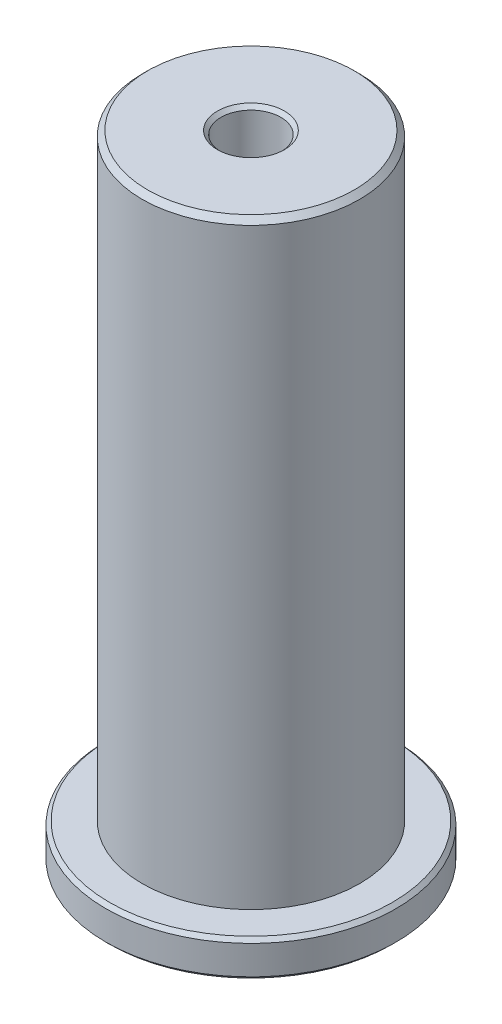
from build123d import *

# Parameters (mm, degrees)
SKETCH_1_R          = 8
SKETCH_1_R_2        = 6
EXTRUDE_1_DEPTH     = 2
SKETCH_1_3_R        = 6
SKETCH_1_3_R_2      = 1.65
EXTRUDE_2_DEPTH     = 35
SKETCH_2_R          = 1
CUT_EXTRUDE_1_DEPTH = 2
CUT_EXTRUDE_START   = 35
SKETCH_1_4_R        = 1.65
CUT_EXTRUDE_2_DEPTH = 13
CHAMFER_1_SIZE      = 0.2
CHAMFER_2_SIZE      = 0.3


with BuildPart() as part:
    # 스케치1 → 보스-돌출1 (new body)
    with BuildSketch(Plane(origin=(0, 0, 0), x_dir=(1, 0, 0), z_dir=(0, 1, 0))):
        with Locations(Location((0, 0, 0), (0, 0, 270))):
            Circle(SKETCH_1_R)
        with Locations(Location((0, 0, 0), (0, 0, 270))):
            Circle(SKETCH_1_R_2, mode=Mode.SUBTRACT)
    extrude(amount=EXTRUDE_1_DEPTH)

    # 스케치1<3> → 보스-돌출2 (add)
    # profile 1 of 2: a face of its own
    with BuildSketch(Plane(origin=(0, 0, 0), x_dir=(1, 0, 0), z_dir=(0, 1, 0))):
        with Locations(Location((0, 0, 0), (0, 0, 270))):
            Circle(SKETCH_1_3_R)
        Circle(SKETCH_1_3_R_2, mode=Mode.SUBTRACT)
    # profile 2 of 2: a face of its own
    with BuildSketch(Plane(origin=(0, 0, 0), x_dir=(1, 0, 0), z_dir=(0, 1, 0))):
        Circle(SKETCH_1_3_R_2)
    extrude(amount=EXTRUDE_2_DEPTH)

    # 스케치2 → 컷-돌출1 (cut)
    with BuildSketch(Plane.XZ):
        with Locations((0, 3)):
            Circle(SKETCH_2_R)
        with BuildLine():
            ThreePointArc((1, 3), (0, 2), (-1, 3))
            Line((-1, 3), (-1, -3))
            ThreePointArc((-1, -3), (0, -2), (1, -3))
            Line((1, -3), (1, 3))
        make_face()
        with Locations((0, -3)):
            Circle(SKETCH_2_R)
    extrude(amount=-CUT_EXTRUDE_1_DEPTH, mode=Mode.SUBTRACT)

    # 스케치1<4> → 컷-돌출2 (cut)
    with BuildSketch(Plane(origin=(0, 0, 0), x_dir=(1, 0, 0), z_dir=(0, 1, 0)).offset(CUT_EXTRUDE_START)):
        with Locations(Location((0, 0, 0), (0, 0, 270))):
            Circle(SKETCH_1_4_R)
    extrude(amount=-CUT_EXTRUDE_2_DEPTH, mode=Mode.SUBTRACT)

    # 모따기1
    chamfer_1_edges = [part.edges().sort_by_distance(p)[0] for p in [
        (0, 2, -8),
        (0, 35, -1.65),
        (0, 0, -8),
    ]]
    chamfer(chamfer_1_edges, length=CHAMFER_1_SIZE)

    # 모따기2
    chamfer_2_edges = [part.edges().sort_by_distance(p)[0] for p in [
        (0, 35, -6),
    ]]
    chamfer(chamfer_2_edges, length=CHAMFER_2_SIZE)

    # 스케치3 → 컷-회전1 (revolve, cut)
    with BuildSketch(Plane.XY, mode=Mode.PRIVATE) as cut_revolve_1_sk:
        Polygon((-1.65, 22), (0, 21.316547622), (0, 22), align=None)
    revolve(cut_revolve_1_sk.sketch.rotate(Axis((0, -0.686408766, 0), (0, 1, 0)), 90), axis=Axis((0, -0.686408766, 0), (0, 1, 0)), mode=Mode.SUBTRACT)


solid = part.part
